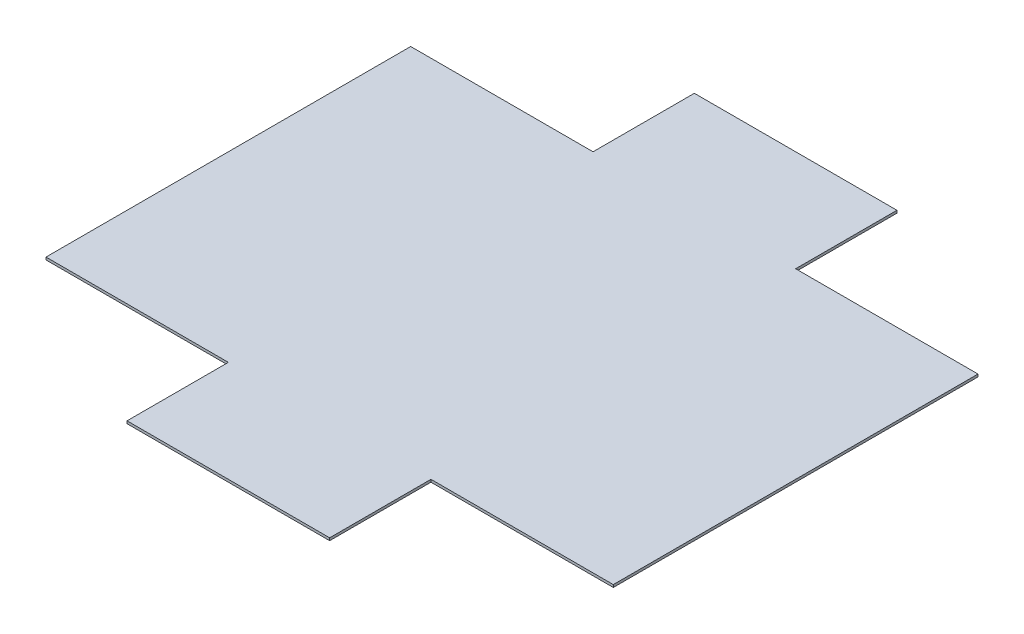
from build123d import *

# Parameters (mm, degrees)
BOSS_EXTRUDE1_DEPTH = 3.175


with BuildPart() as part:
    # Sketch1 → Boss-Extrude1 (new body)
    with BuildSketch(Plane(origin=(0, 0, 0), x_dir=(1, 0, 0), z_dir=(0, 1, 0))):
        Polygon((0, 584.2), (228.6, 584.2), (228.6, 711.2), (482.6, 711.2), (482.6, 584.2), (711.2, 584.2), (711.2, 127), (482.6, 127), (482.6, 0), (228.6, 0), (228.6, 127), (0, 127), align=None)
    extrude(amount=BOSS_EXTRUDE1_DEPTH)


solid = part.part
